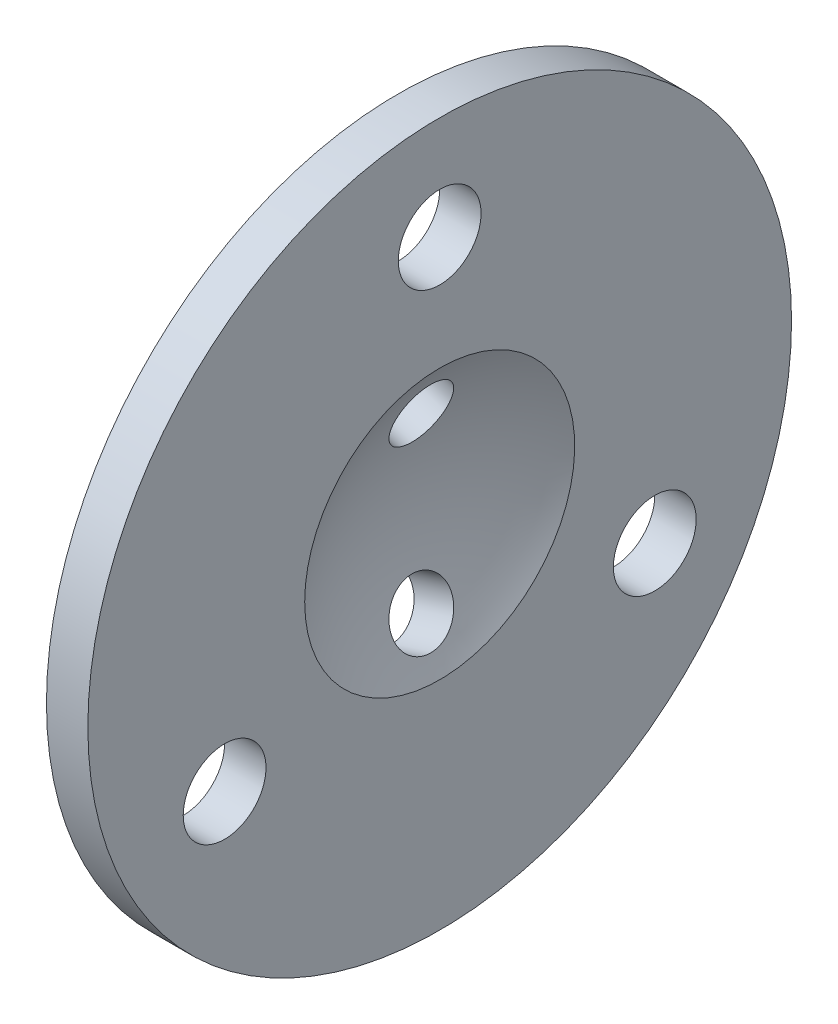
from build123d import *

# Parameters (mm, degrees)
SKETCH_3_R          = 2
CUT_EXTRUDE_1_DEPTH = 10


with BuildPart() as part:
    # 草图1 → 旋转3 (revolve)
    with BuildSketch(Plane.XY):
        with BuildLine():
            Line((-14.38749457, 17), (-12.38749457, 17))
            Line((-12.38749457, 17), (-12.38749457, 6.523034438))
            ThreePointArc((-12.38749457, 6.523034438), (-13.590896291, 3.359693142), (-14, 0))
            Line((-14, 0), (-16, 0))
            ThreePointArc((-16, 0), (-15.591663047, 3.591663047), (-14.38749457, 7))
            Line((-14.38749457, 7), (-14.38749457, 17))
        make_face()
    revolve(axis=Axis((-26.155193714, 0, 0), (1, 0, 0)))

    # 草图2 → 切除-旋转1 (revolve, cut)
    with BuildSketch(Plane.XY):
        Polygon((-10.99354471, 5.03904502), (-18.623280316, 7.444691416), (-19.074339015, 6.01411599), (-11.444603409, 3.608469594), align=None)
    cut_revolve_1 = revolve(axis=Axis((0, 0, 0), (-0.9537169507482267, 0.30070579950427373, 0)), mode=Mode.SUBTRACT)

    # 镜向1: 切除-旋转1 across plane
    add(cut_revolve_1.mirror(Plane.ZX), mode=Mode.SUBTRACT)

    # 草图3 → 切除-拉伸1 (cut)
    with BuildSketch(Plane.ZY.offset(14.38749457)):
        with Locations((0, 12)):
            Circle(SKETCH_3_R)
        with Locations((10.392304845, -6)):
            Circle(SKETCH_3_R)
        with Locations((-10.392304845, -6)):
            Circle(SKETCH_3_R)
    extrude(amount=-CUT_EXTRUDE_1_DEPTH, mode=Mode.SUBTRACT)


solid = part.part
